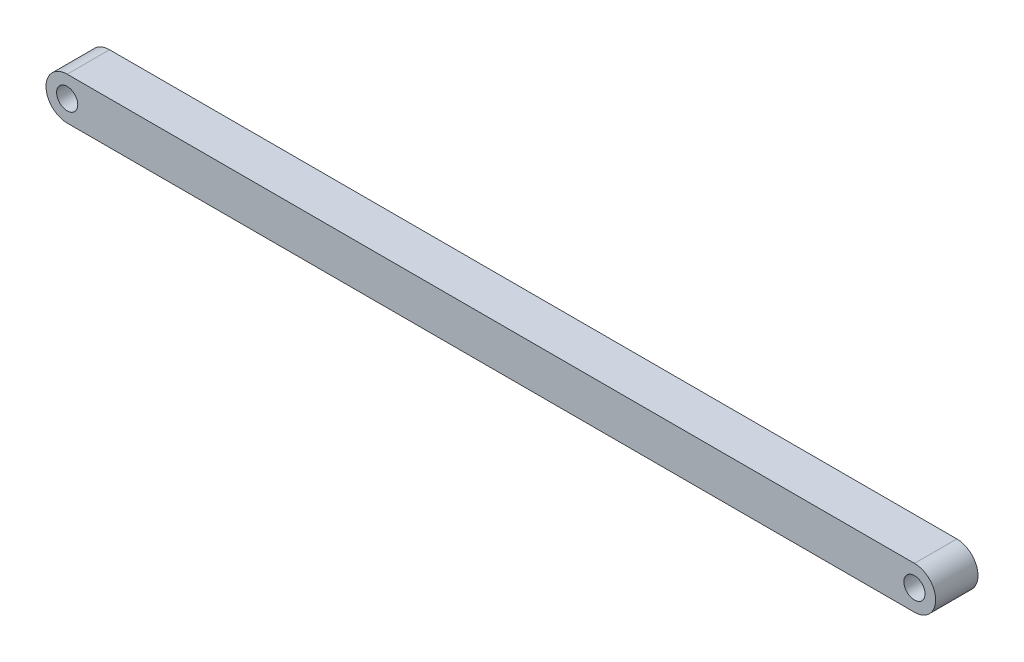
from build123d import *

# Parameters (mm, degrees)
SKETCH1_R           = 1.25
BOSS_EXTRUDE1_DEPTH = 5


with BuildPart() as part:
    # Sketch1 → Boss-Extrude1 (new body)
    with BuildSketch(Plane.XY):
        with BuildLine():
            Line((-50, 2.5), (50, 2.5))
            ThreePointArc((50, 2.5), (52.5, 0), (50, -2.5))
            Line((50, -2.5), (-50, -2.5))
            ThreePointArc((-50, -2.5), (-52.5, 0), (-50, 2.5))
        make_face()
        with Locations((-50, 0)):
            Circle(SKETCH1_R, mode=Mode.SUBTRACT)
        with Locations((50, 0)):
            Circle(SKETCH1_R, mode=Mode.SUBTRACT)
    extrude(amount=BOSS_EXTRUDE1_DEPTH)


solid = part.part
